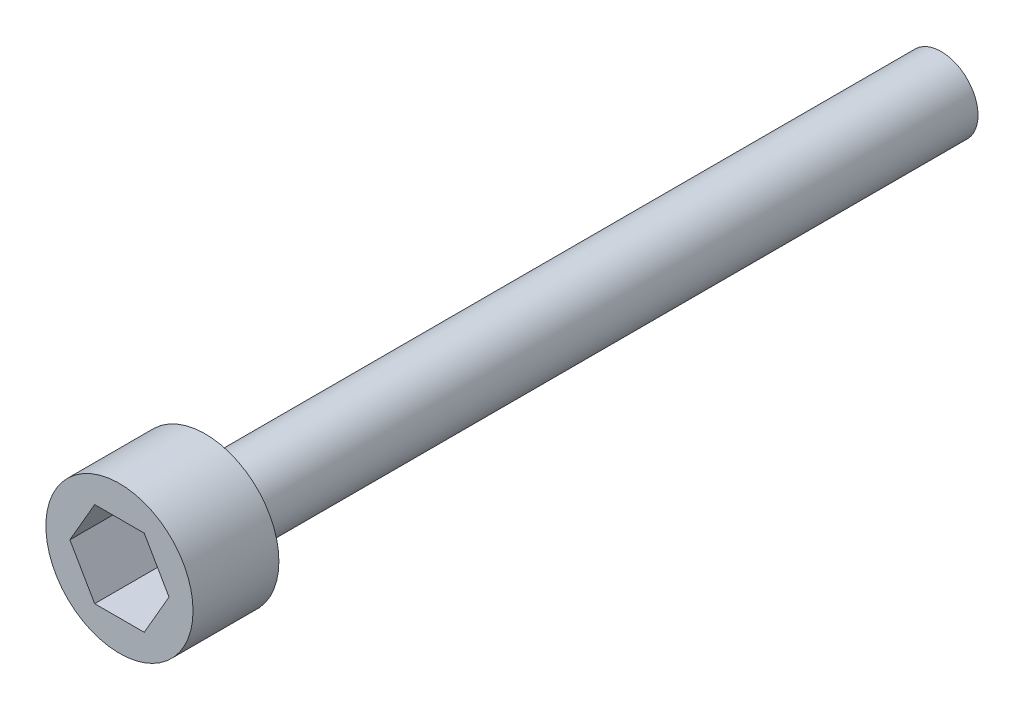
from build123d import *

# Parameters (mm, degrees)
SKETCH1_R                   = 3
HEAD_BOSS_EXTRUDE1_DEPTH    = 3.5
HEAD_HEX_CUT_EXTRUDE1_DEPTH = 2.8
SKETCH2_R                   = 1.5
SCREW_BOSS_EXTRUDE2_DEPTH   = 30


with BuildPart() as part:
    # Sketch1 → Head Boss-Extrude1 (new body)
    with BuildSketch(Plane.XY):
        Circle(SKETCH1_R)
    extrude(amount=HEAD_BOSS_EXTRUDE1_DEPTH)

    # Sketch3 → Head Hex Cut-Extrude1 (cut)
    with BuildSketch(Plane.XY.offset(3.5)):
        Polygon((-1.010362971, 1.75), (1.010362971, 1.75), (2.020725942, 0), (1.010362971, -1.75), (-1.010362971, -1.75), (-2.020725942, 0), align=None)
    extrude(amount=-HEAD_HEX_CUT_EXTRUDE1_DEPTH, mode=Mode.SUBTRACT)

    # Sketch2 → Screw Boss-Extrude2 (add)
    with BuildSketch(Plane.XY):
        Circle(SKETCH2_R)
    extrude(amount=-SCREW_BOSS_EXTRUDE2_DEPTH)


solid = part.part
